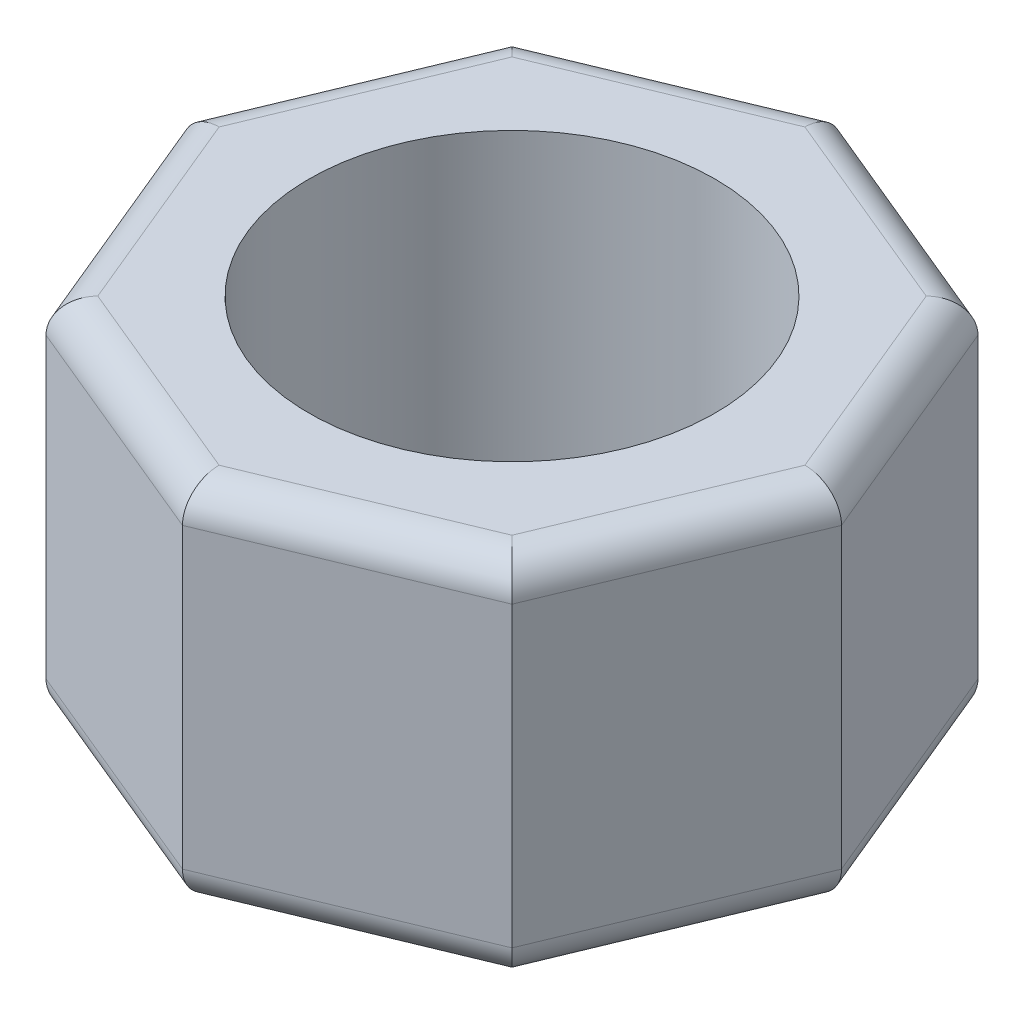
from build123d import *

# Parameters (mm, degrees)
SKETCH1_R           = 6
BOSS_EXTRUDE1_DEPTH = 10.8
FILLET1_R           = 1


with BuildPart() as part:
    # Sketch1 → Boss-Extrude1 (new body)
    with BuildSketch(Plane(origin=(0, 0, 0), x_dir=(1, 0, 0), z_dir=(0, 1, 0))):
        Polygon((9.741529803, 0), (6.888301783, 6.888301783), (0, 9.741529803), (-6.888301783, 6.888301783), (-9.741529803, 0), (-6.888301783, -6.888301783), (0, -9.741529803), (6.888301783, -6.888301783), align=None)
        with Locations(Location((0, 0, 0), (0, 0, 90))):
            Circle(SKETCH1_R, mode=Mode.SUBTRACT)
    extrude(amount=BOSS_EXTRUDE1_DEPTH)

    # Fillet1
    fillet1_edges = [part.edges().sort_by_distance(p)[0] for p in [
        (3.444150891, 10.8, -8.314915793),
        (8.314915793, 0, -3.444150891),
        (8.314915793, 0, 3.444150891),
        (-3.444150891, 10.8, -8.314915793),
        (-8.314915793, 10.8, -3.444150891),
        (-8.314915793, 10.8, 3.444150891),
        (-3.444150891, 10.8, 8.314915793),
        (3.444150891, 10.8, 8.314915793),
        (8.314915793, 10.8, 3.444150891),
        (8.314915793, 10.8, -3.444150891),
        (3.444150891, 0, 8.314915793),
        (-3.444150891, 0, 8.314915793),
        (-8.314915793, 0, 3.444150891),
        (-8.314915793, 0, -3.444150891),
        (-3.444150891, 0, -8.314915793),
        (3.444150891, 0, -8.314915793),
    ]]
    fillet(fillet1_edges, radius=FILLET1_R)


solid = part.part
